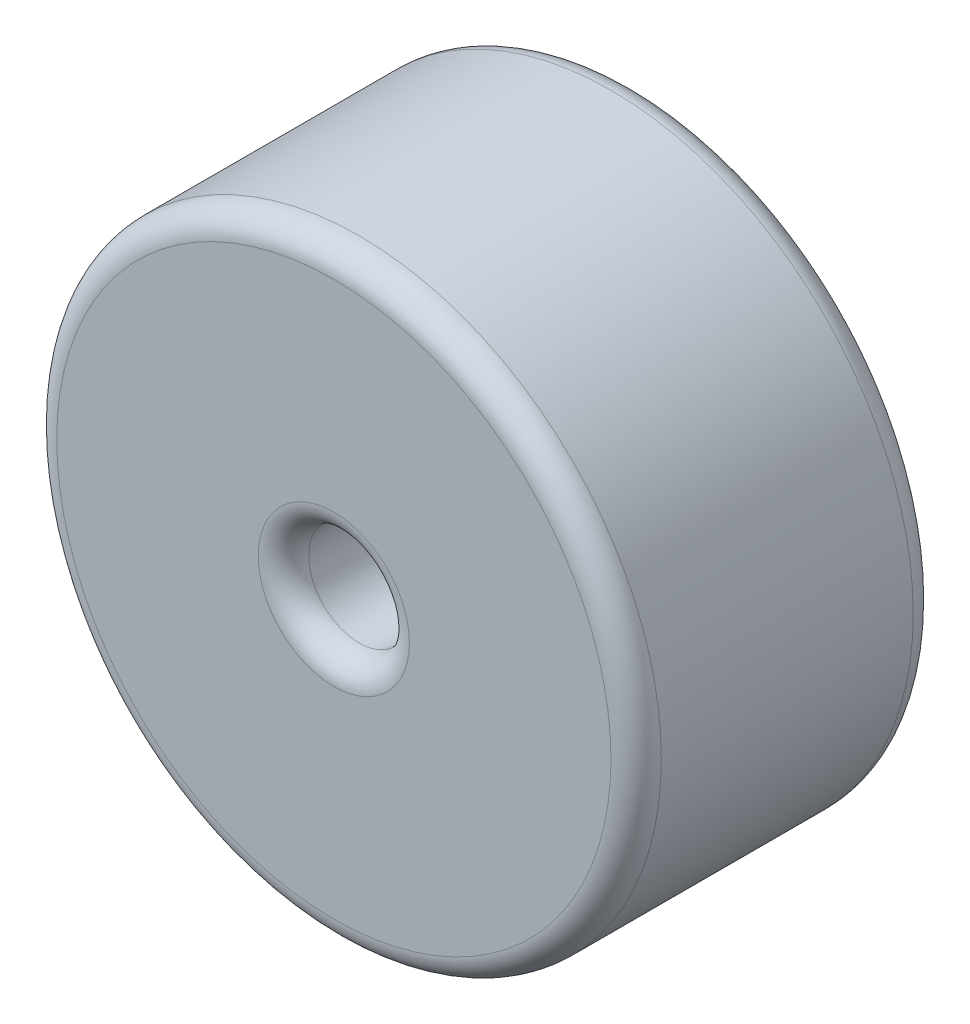
from build123d import *

# Parameters (mm, degrees)
SKETCH_1_R          = 12
EXTRUDE_1_DEPTH     = 12
FILLET_1_R          = 1
SKETCH_2_R          = 2
CUT_EXTRUDE_1_DEPTH = 12
FILLET_2_R          = 1


with BuildPart() as part:
    # 草图1 → 凸台-拉伸1 (new body)
    with BuildSketch(Plane.XY):
        Circle(SKETCH_1_R)
    extrude(amount=EXTRUDE_1_DEPTH)

    # 圆角1
    fillet_1_edges = [part.edges().sort_by_distance(p)[0] for p in [
        (-12, 0, 0),
        (-12, 0, 12),
    ]]
    fillet(fillet_1_edges, radius=FILLET_1_R)

    # 草图2 → 切除-拉伸1 (cut)
    with BuildSketch(Plane(origin=(0, 0, 0), x_dir=(-1, 0, 0), z_dir=(0, 0, -1))):
        Circle(SKETCH_2_R)
    extrude(amount=-CUT_EXTRUDE_1_DEPTH, mode=Mode.SUBTRACT)

    # 圆角2
    fillet_2_edges = [part.edges().sort_by_distance(p)[0] for p in [
        (2, 0, 12),
        (2, 0, 0),
    ]]
    fillet(fillet_2_edges, radius=FILLET_2_R)


solid = part.part
